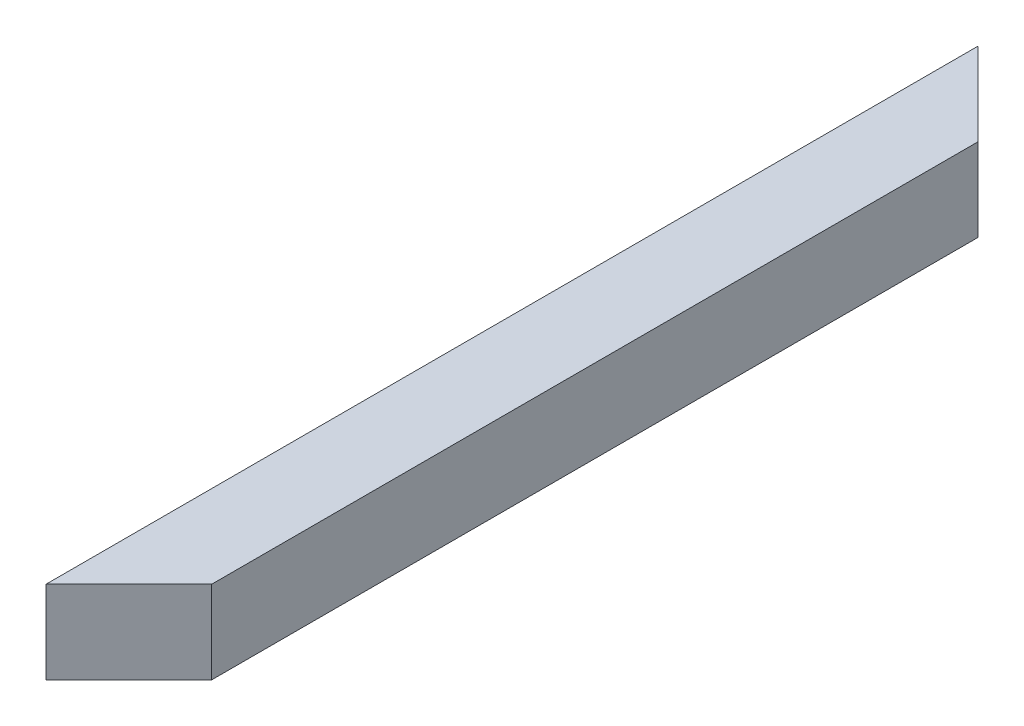
from build123d import *

# Parameters (mm, degrees)
EXTRUDE_1_DEPTH = 40


with BuildPart() as part:
    # Эскиз1 → Бобышка-Вытянуть1 (new body)
    with BuildSketch(Plane(origin=(0, 0, 0), x_dir=(1, 0, 0), z_dir=(0, 1, 0))):
        Polygon((-177.83770196, -16.893149455), (-137.83770196, 23.106850545), (-137.83770196, 393.106850545), (-177.83770196, 433.106850545), align=None)
    extrude(amount=EXTRUDE_1_DEPTH)


solid = part.part
